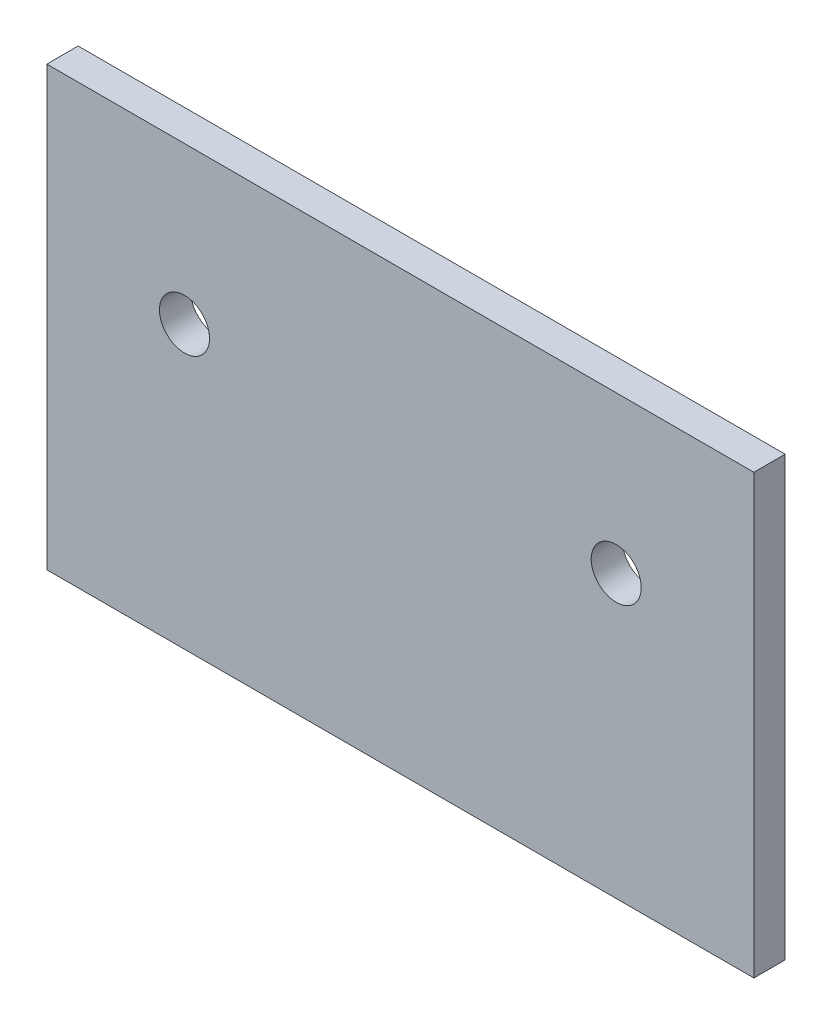
from build123d import *

# Parameters (mm, degrees)
SKETCH_1_W      = 113
SKETCH_1_H      = 70
SKETCH_1_R      = 4
EXTRUDE_1_DEPTH = 5


with BuildPart() as part:
    # 草图1 → 凸台-拉伸1 (new body)
    with BuildSketch(Plane.XY):
        Rectangle(SKETCH_1_W, SKETCH_1_H)
        with Locations((-34.5, 10)):
            Circle(SKETCH_1_R, mode=Mode.SUBTRACT)
        with Locations((34.5, 10)):
            Circle(SKETCH_1_R, mode=Mode.SUBTRACT)
    extrude(amount=EXTRUDE_1_DEPTH)


solid = part.part
